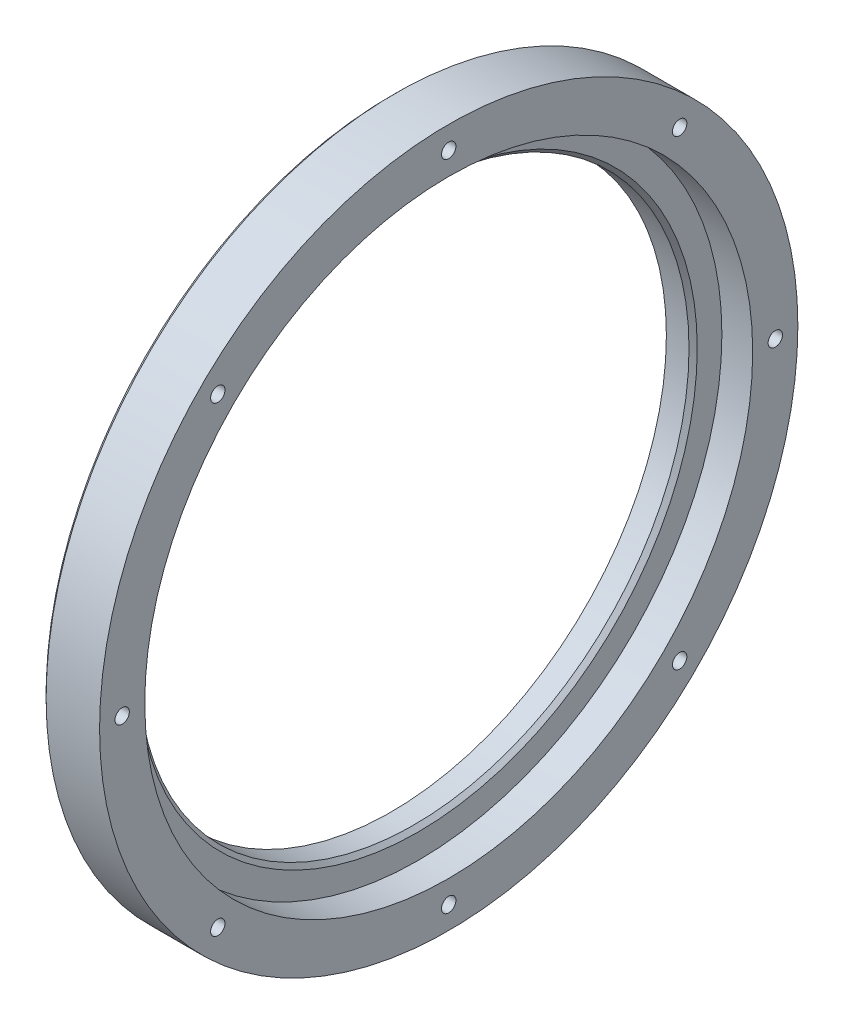
from build123d import *

# Parameters (mm, degrees)
SZKIC2_R                   = 1.75
WYTNIJ_WYCI_GNI_CIE1_DEPTH = 122.733164786
SZKIC4_R                   = 3
WYTNIJ_WYCI_GNI_CIE2_DEPTH = 4
SFAZOWANIE1_SIZE           = 1


with BuildPart() as part:
    # Szkic1 → Obrót1 (revolve)
    with BuildSketch(Plane.XY, mode=Mode.PRIVATE) as obr_t1_sk:
        Polygon((-272.858046523, 75.009269975), (-280.358046523, 75.009269975), (-280.358046523, 68.009269975), (-286.871214876, 68.009269975), (-286.871214876, 85.009269975), (-285.871214876, 86.009269975), (-272.858046523, 86.009269975), align=None)
    revolve(obr_t1_sk.sketch.rotate(Axis((-268.908046523, 1.009269975, 0), (-1, 0, 0)), 90), axis=Axis((-268.908046523, 1.009269975, 0), (-1, 0, 0)))

    # Szkic2 → Wytnij-wyciągnięcie1 (cut, through all)
    with BuildSketch(Plane.ZY.offset(286.871214876)):
        with Locations((79.5, 1.009269975)):
            Circle(SZKIC2_R)
        with Locations((56.214989104, -55.20571913)):
            Circle(SZKIC2_R)
        with Locations((0, -78.490730025)):
            Circle(SZKIC2_R)
        with Locations((-56.214989104, -55.20571913)):
            Circle(SZKIC2_R)
        with Locations((-79.5, 1.009269975)):
            Circle(SZKIC2_R)
        with Locations((-56.214989104, 57.224259079)):
            Circle(SZKIC2_R)
        with Locations((0, 80.509269975)):
            Circle(SZKIC2_R)
        with Locations((56.214989104, 57.224259079)):
            Circle(SZKIC2_R)
    extrude(amount=-WYTNIJ_WYCI_GNI_CIE1_DEPTH, mode=Mode.SUBTRACT)

    # Szkic4 → Wytnij-wyciągnięcie2 (cut)
    with BuildSketch(Plane.ZY.offset(286.871214876)):
        with Locations((79.5, 1.009269975)):
            Circle(SZKIC4_R)
        with Locations((56.214989104, -55.20571913)):
            Circle(SZKIC4_R)
        with Locations((0, -78.490730025)):
            Circle(SZKIC4_R)
        with Locations((-56.214989104, -55.20571913)):
            Circle(SZKIC4_R)
        with Locations((-79.5, 1.009269975)):
            Circle(SZKIC4_R)
        with Locations((-56.214989104, 57.224259079)):
            Circle(SZKIC4_R)
        with Locations((0, 80.509269975)):
            Circle(SZKIC4_R)
        with Locations((56.214989104, 57.224259079)):
            Circle(SZKIC4_R)
    extrude(amount=-WYTNIJ_WYCI_GNI_CIE2_DEPTH, mode=Mode.SUBTRACT)

    # Sfazowanie1
    sfazowanie1_edges = [part.edges().sort_by_distance(p)[0] for p in [
        (-280.358046523, 1.009269975, 67),
    ]]
    chamfer(sfazowanie1_edges, length=SFAZOWANIE1_SIZE)


solid = part.part
